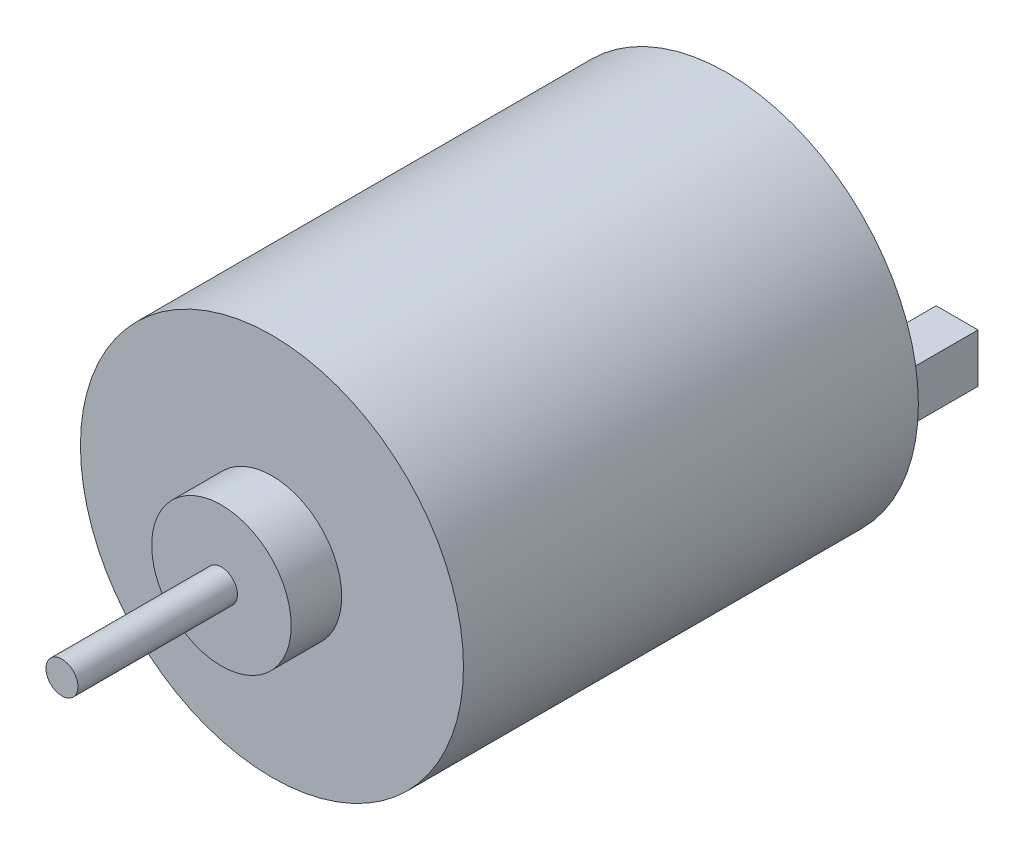
from build123d import *

# Parameters (mm, degrees)
SKETCH1_R           = 13.725
BOSS_EXTRUDE1_DEPTH = 32.6
SKETCH2_R           = 5
BOSS_EXTRUDE2_DEPTH = 3.62
SKETCH3_R           = 1.145
BOSS_EXTRUDE3_DEPTH = 11.43
BOSS_EXTRUDE4_START = 2.15
SKETCH4_R           = 5
BOSS_EXTRUDE4_DEPTH = 2.15
SKETCH5_R           = 1.15
BOSS_EXTRUDE5_DEPTH = 1
SKETCH6_W           = 3
SKETCH6_H           = 3.5
BOSS_EXTRUDE6_DEPTH = 5


with BuildPart() as part:
    # Sketch1 → Boss-Extrude1 (new body)
    with BuildSketch(Plane.XY):
        Circle(SKETCH1_R)
    extrude(amount=BOSS_EXTRUDE1_DEPTH)

    # Sketch2 → Boss-Extrude2 (add)
    with BuildSketch(Plane.XY.offset(32.6)):
        Circle(SKETCH2_R)
    extrude(amount=BOSS_EXTRUDE2_DEPTH)

    # Sketch3 → Boss-Extrude3 (add)
    with BuildSketch(Plane.XY.offset(36.22)):
        Circle(SKETCH3_R)
    extrude(amount=BOSS_EXTRUDE3_DEPTH)

    # Sketch4 → Boss-Extrude4 (add)
    with BuildSketch(Plane(origin=(0, 0, 0), x_dir=(-1, 0, 0), z_dir=(0, 0, -1)).offset(BOSS_EXTRUDE4_START)):
        with Locations(Location((0, 0, 0), (0, 0, 180))):
            Circle(SKETCH4_R)
    extrude(amount=-BOSS_EXTRUDE4_DEPTH)

    # Sketch5 → Boss-Extrude5 (add)
    with BuildSketch(Plane(origin=(0, 0, -2.15), x_dir=(-1, 0, 0), z_dir=(0, 0, -1))):
        Circle(SKETCH5_R)
    extrude(amount=BOSS_EXTRUDE5_DEPTH)

    # Sketch6 → Boss-Extrude6 (add)
    with BuildSketch(Plane(origin=(0, 0, 0), x_dir=(-1, 0, 0), z_dir=(0, 0, -1))):
        with Locations((-11.5, 0)):
            Rectangle(SKETCH6_W, SKETCH6_H)
        with Locations((11.5, 0)):
            Rectangle(SKETCH6_W, SKETCH6_H)
    extrude(amount=BOSS_EXTRUDE6_DEPTH)


solid = part.part
